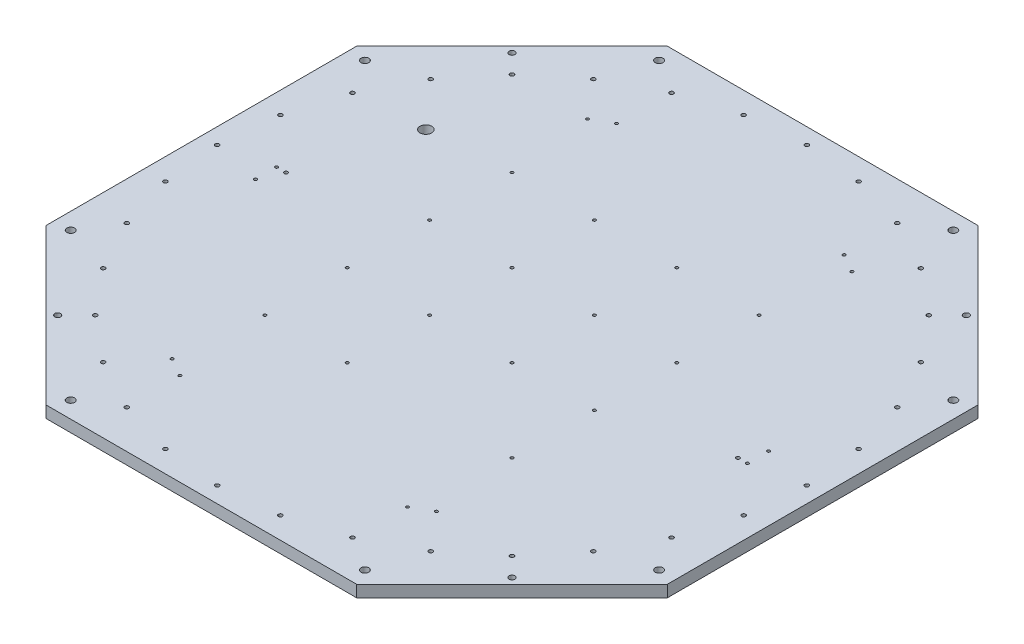
from build123d import *

# Parameters (mm, degrees)
BOSS_EXTRUDE1_DEPTH          = 5
M3_CLEARANCE_HOLE1_D         = 3.4
M3X0_5_TAPPED_HOLE1_D        = 2.5
M3X0_5_TAPPED_HOLE1_DEPTH    = 7.5
M3X0_5_TAPPED_HOLE1_TIP      = 0.751075774
F_3_0MM_DOWEL_HOLE1_D        = 3
F_3_0MM_DOWEL_HOLE1_DEPTH    = 6
F_3_0MM_DOWEL_HOLE1_TIP      = 0.901290929
M3X0_5_TAPPED_HOLE2_D        = 2.5
M3X0_5_TAPPED_HOLE2_DEPTH    = 7.5
M3X0_5_TAPPED_HOLE2_TIP      = 0.751075774
M6X1_0_TAPPED_HOLE1_D        = 5
M6_CLEARANCE_HOLE1_D         = 6.6
F_7_16_20_TAPPED_HOLE1_D     = 9.92124
F_7_16_20_TAPPED_HOLE1_DEPTH = 17
F_7_16_20_TAPPED_HOLE1_TIP   = 2.980641204


with BuildPart() as part:
    # Sketch1 → Boss-Extrude1 (new, symmetric)
    with BuildSketch(Plane(origin=(0, 0, 0), x_dir=(1, 0, 0), z_dir=(0, 1, 0))):
        Polygon((-131.979797464, 264), (131.979797464, 264), (264, 131.979797464), (264, -131.979797464), (131.979797464, -264), (-131.979797464, -264), (-264, -131.979797464), (-264, 131.979797464), align=None)
    extrude(amount=BOSS_EXTRUDE1_DEPTH, both=True)

    # M3 Clearance Hole1 (through all)
    with Locations(Plane(origin=(0, 5, 0), x_dir=(1, 0, 0), z_dir=(0, 1, 0))):
        with Locations((250.5, 0), (245.686712741, -48.870125665), (231.431822894, -95.862199807), (208.283137882, -139.170343371), (177.130248687, -177.130248687), (139.170343371, -208.283137882), (95.862199807, -231.431822894), (48.870125665, -245.686712741), (0, -250.5), (-48.870125665, -245.686712741), (-95.862199807, -231.431822894), (-139.170343371, -208.283137882), (-177.130248687, -177.130248687), (-208.283137882, -139.170343371), (-231.431822894, -95.862199807), (-245.686712741, -48.870125665), (-250.5, 0), (-245.686712741, 48.870125665), (-231.431822894, 95.862199807), (-208.283137882, 139.170343371), (-177.130248687, 177.130248687), (-139.170343371, 208.283137882), (-95.862199807, 231.431822894), (-48.870125665, 245.686712741), (0, 250.5), (48.870125665, 245.686712741), (95.862199807, 231.431822894), (139.170343371, 208.283137882), (177.130248687, 177.130248687), (208.283137882, 139.170343371), (231.431822894, 95.862199807), (245.686712741, 48.870125665)):
            Hole(M3_CLEARANCE_HOLE1_D / 2)

    # M3x0.5 Tapped Hole1
    with Locations(Plane(origin=(0, 5, 0), x_dir=(1, 0, 0), z_dir=(0, 1, 0))):
        with Locations((209, 9), (209, -9), (112.294228634, -176.499309391), (96.705771366, -185.499309391), (-96.705771366, -185.499309391), (-112.294228634, -176.499309391), (-209, -9), (-209, 9), (-112.294228634, 176.499309391), (-96.705771366, 185.499309391), (96.705771366, 185.499309391), (112.294228634, 176.499309391)):
            Hole(M3X0_5_TAPPED_HOLE1_D / 2, depth=M3X0_5_TAPPED_HOLE1_DEPTH)
            with Locations((0, 0, -(M3X0_5_TAPPED_HOLE1_DEPTH + M3X0_5_TAPPED_HOLE1_TIP / 2))):  # 118° drill point
                Cone(0, M3X0_5_TAPPED_HOLE1_D / 2, M3X0_5_TAPPED_HOLE1_TIP, mode=Mode.SUBTRACT)

    # Ø3.0mm Dowel Hole1
    with Locations(Plane(origin=(0, 5, 0), x_dir=(1, 0, 0), z_dir=(0, 1, 0))):
        with Locations((201, -9), (-201, 9)):
            Hole(F_3_0MM_DOWEL_HOLE1_D / 2, depth=F_3_0MM_DOWEL_HOLE1_DEPTH)
            with Locations((0, 0, -(F_3_0MM_DOWEL_HOLE1_DEPTH + F_3_0MM_DOWEL_HOLE1_TIP / 2))):  # 118° drill point
                Cone(0, F_3_0MM_DOWEL_HOLE1_D / 2, F_3_0MM_DOWEL_HOLE1_TIP, mode=Mode.SUBTRACT)

    # M3x0.5 Tapped Hole2
    with Locations(Plane(origin=(0, 5, 0), x_dir=(1, 0, 0), z_dir=(0, 1, 0))):
        with Locations((-105, -105), (-35, -105), (105, -105), (-35, -35), (35, -35), (105, -35), (-35, 35), (35, 35), (105, 35), (-35, 105), (35, 105), (105, 105), (-105, -35), (-105, 35), (-105, 105)):
            Hole(M3X0_5_TAPPED_HOLE2_D / 2, depth=M3X0_5_TAPPED_HOLE2_DEPTH)
            with Locations((0, 0, -(M3X0_5_TAPPED_HOLE2_DEPTH + M3X0_5_TAPPED_HOLE2_TIP / 2))):  # 118° drill point
                Cone(0, M3X0_5_TAPPED_HOLE2_D / 2, M3X0_5_TAPPED_HOLE2_TIP, mode=Mode.SUBTRACT)

    # M6x1.0 Tapped Hole1 (through all)
    with Locations(Plane(origin=(0, 5, 0), x_dir=(1, 0, 0), z_dir=(0, 1, 0))):
        with Locations((-193.040151264, -193.040151264), (-193.040151264, 193.040151264), (193.040151264, 193.040151264), (193.040151264, -193.040151264)):
            Hole(M6X1_0_TAPPED_HOLE1_D / 2)

    # M6 Clearance Hole1 (through all)
    with Locations(Plane(origin=(0, 5, 0), x_dir=(1, 0, 0), z_dir=(0, 1, 0))):
        with Locations((-125, -250), (-250, -125), (-125, 250), (-250, 125), (125, -250), (250, -125), (250, 125), (125, 250)):
            Hole(M6_CLEARANCE_HOLE1_D / 2)

    # 7/16-20 Tapped Hole1
    with Locations(Plane(origin=(0, -5, 0), x_dir=(-1, 0, 0), z_dir=(0, -1, 0))):
        with Locations((173.205080757, 100)):
            Hole(F_7_16_20_TAPPED_HOLE1_D / 2, depth=F_7_16_20_TAPPED_HOLE1_DEPTH)
            with Locations((0, 0, -(F_7_16_20_TAPPED_HOLE1_DEPTH + F_7_16_20_TAPPED_HOLE1_TIP / 2))):  # 118° drill point
                Cone(0, F_7_16_20_TAPPED_HOLE1_D / 2, F_7_16_20_TAPPED_HOLE1_TIP, mode=Mode.SUBTRACT)


solid = part.part
